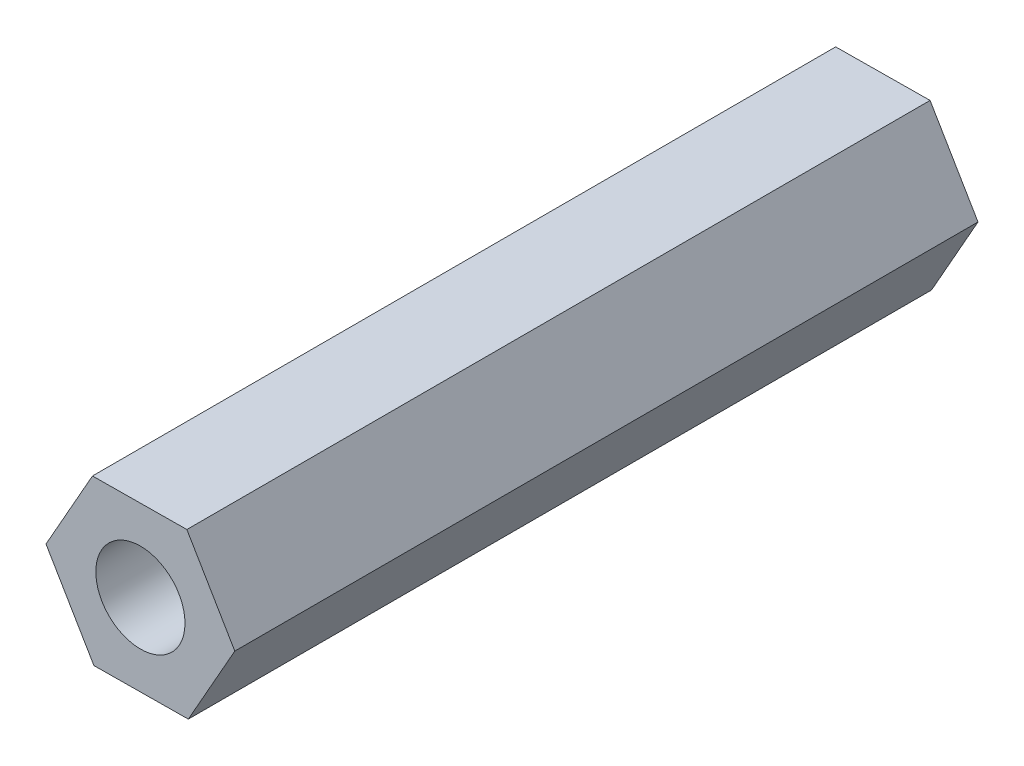
from build123d import *

# Parameters (mm, degrees)
SKETCH_1_R      = 1.5
EXTRUDE_1_DEPTH = 25


with BuildPart() as part:
    # 草图1 → 凸台-拉伸1 (new body)
    with BuildSketch(Plane.XY):
        Polygon((1.61185848, -2.735917684), (3.175303457, 0.027951549), (1.563444977, 2.763869233), (-1.61185848, 2.735917684), (-3.175303457, -0.027951549), (-1.563444977, -2.763869233), align=None)
        Circle(SKETCH_1_R, mode=Mode.SUBTRACT)
    extrude(amount=EXTRUDE_1_DEPTH)


solid = part.part
